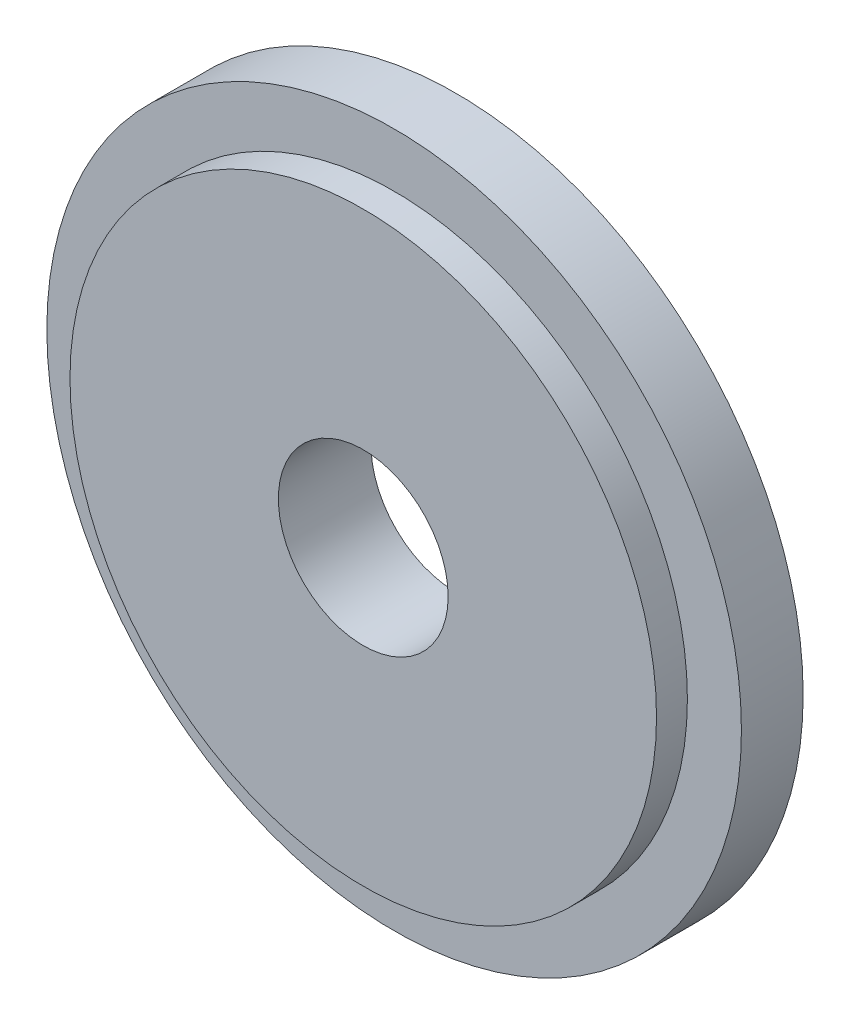
from build123d import *

# Parameters (mm, degrees)
SKETCH_1_R          = 22.5
EXTRUDE_1_DEPTH     = 4
SKETCH_2_R          = 19
EXTRUDE_2_DEPTH     = 2
SKETCH_3_R          = 5.5
CUT_EXTRUDE_3_DEPTH = 33.380549717


with BuildPart() as part:
    # 草图1 → 拉伸1 (new body)
    with BuildSketch(Plane.XY):
        Circle(SKETCH_1_R)
    extrude(amount=EXTRUDE_1_DEPTH)

    # 草图2 → 拉伸2 (add)
    with BuildSketch(Plane.XY.offset(4)):
        Circle(SKETCH_2_R)
    extrude(amount=EXTRUDE_2_DEPTH)

    # 草图3 → 拉伸3 (cut, through all)
    with BuildSketch(Plane.XY.offset(6)):
        Circle(SKETCH_3_R)
    extrude(amount=-CUT_EXTRUDE_3_DEPTH, mode=Mode.SUBTRACT)


solid = part.part
